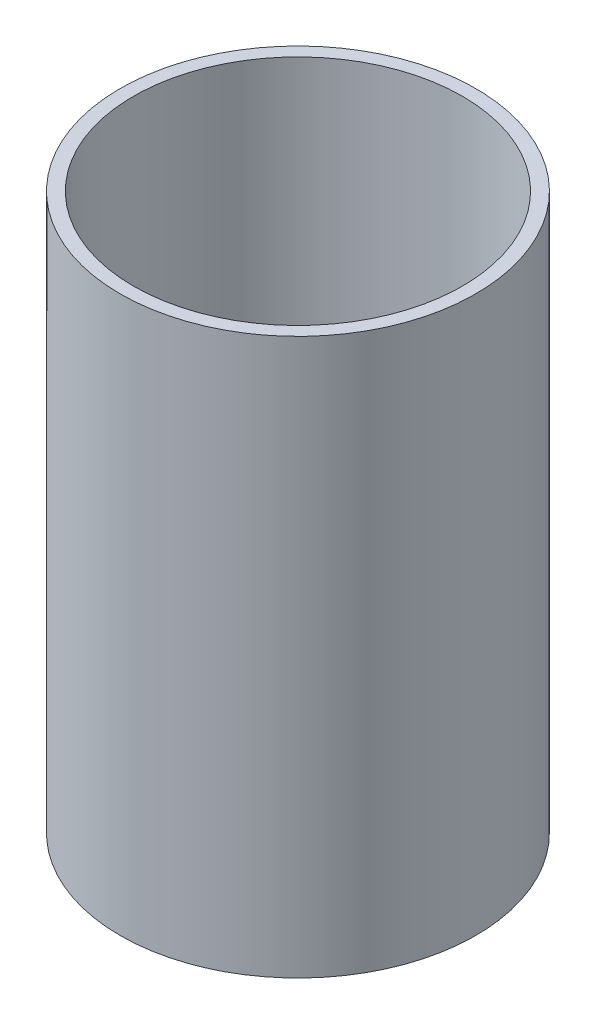
from build123d import *

# Parameters (mm, degrees)
SKETCH1_R           = 16
SKETCH1_R_2         = 14.8
BOSS_EXTRUDE1_DEPTH = 50
SKETCH2_R           = 0.5
CUT_EXTRUDE1_DEPTH  = 55.881690936


with BuildPart() as part:
    # Sketch1 → Boss-Extrude1 (new body)
    with BuildSketch(Plane(origin=(0, 0, 0), x_dir=(1, 0, 0), z_dir=(0, 1, 0))):
        with Locations(Location((0, 0, 0), (0, 0, 270))):
            Circle(SKETCH1_R)
        with Locations(Location((0, 0, 0), (0, 0, 270))):
            Circle(SKETCH1_R_2, mode=Mode.SUBTRACT)
    extrude(amount=BOSS_EXTRUDE1_DEPTH)

    # Sketch2 → Cut-Extrude1 (cut, through all)
    with BuildSketch(Plane(origin=(0, 0, 0), x_dir=(0, 0, -1), z_dir=(1, 0, 0))):
        with Locations((0, 25)):
            Circle(SKETCH2_R)
    extrude(amount=-CUT_EXTRUDE1_DEPTH, mode=Mode.SUBTRACT)


solid = part.part
